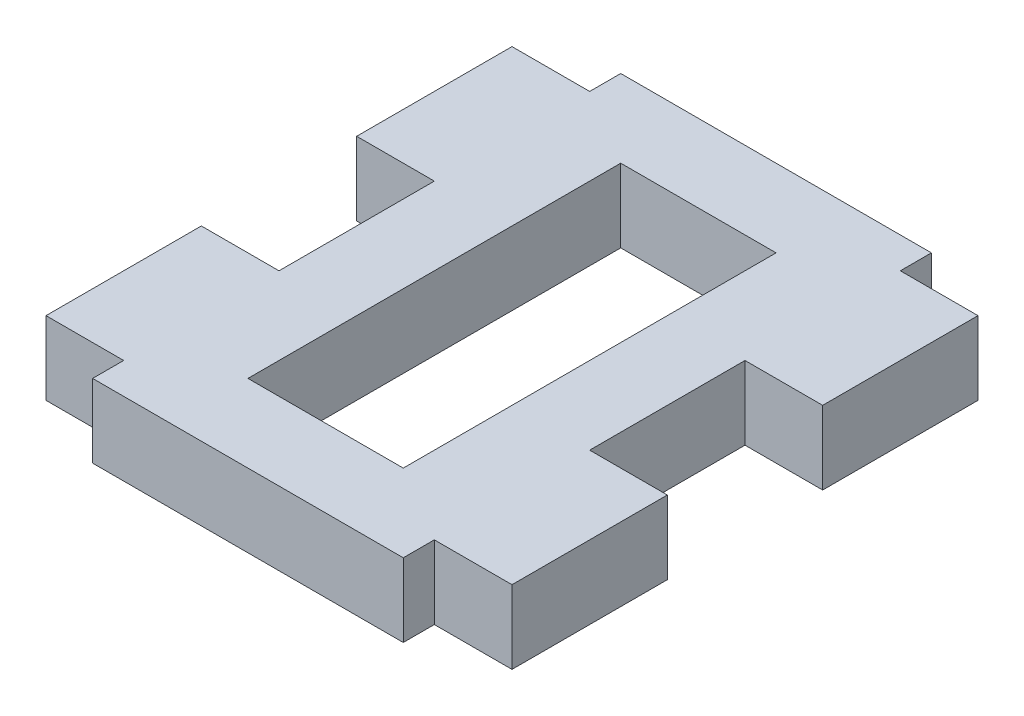
from build123d import *

# Parameters (mm, degrees)
SKETCH1_W           = 25.4
SKETCH1_H           = 43.18
BOSS_EXTRUDE1_DEPTH = 6
SKETCH2_W           = 6.35
SKETCH2_H           = 12.7
BOSS_EXTRUDE2_DEPTH = 6
SKETCH3_W           = 12.7
SKETCH3_H           = 30.48
CUT_EXTRUDE1_DEPTH  = 30.411402551


with BuildPart() as part:
    # Sketch1 → Boss-Extrude1 (new body)
    with BuildSketch(Plane(origin=(0, 0, 0), x_dir=(1, 0, 0), z_dir=(0, 1, 0))):
        Rectangle(SKETCH1_W, SKETCH1_H)
    extrude(amount=BOSS_EXTRUDE1_DEPTH)

    # Sketch2 → Boss-Extrude2 (add)
    with BuildSketch(Plane.XZ):
        with Locations((-15.875, 12.7)):
            Rectangle(SKETCH2_W, SKETCH2_H)
        with Locations((15.875, 12.7)):
            Rectangle(SKETCH2_W, SKETCH2_H)
        with Locations((15.875, -12.7)):
            Rectangle(SKETCH2_W, SKETCH2_H)
        with Locations((-15.875, -12.7)):
            Rectangle(SKETCH2_W, SKETCH2_H)
    extrude(amount=-BOSS_EXTRUDE2_DEPTH)

    # Sketch3 → Cut-Extrude1 (cut, through all)
    with BuildSketch(Plane.XZ):
        Rectangle(SKETCH3_W, SKETCH3_H)
    extrude(amount=-CUT_EXTRUDE1_DEPTH, mode=Mode.SUBTRACT)


solid = part.part
